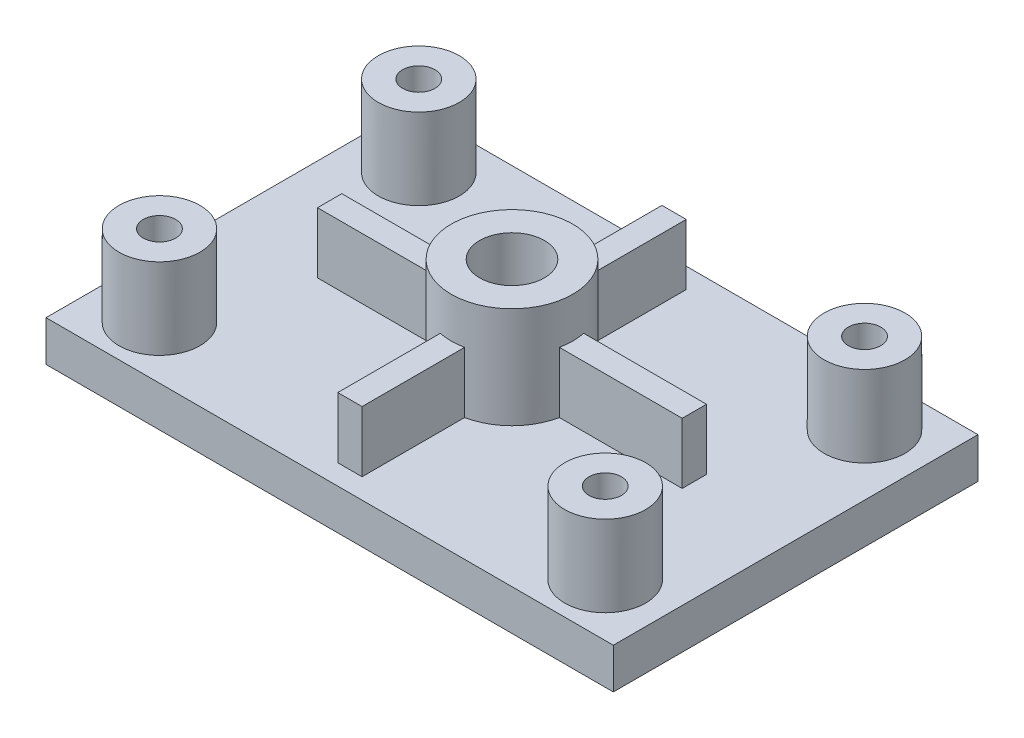
from build123d import *

# Parameters (mm, degrees)
SKETCH_1_W          = 140
SKETCH_1_H          = 90
EXTRUDE_1_DEPTH     = 10
SKETCH_2_W          = 80
SKETCH_2_H          = 50
CUT_EXTRUDE_1_DEPTH = 4
SKETCH_3_W          = 90
SKETCH_3_H          = 6
EXTRUDE_2_DEPTH     = 15
SKETCH_4_W          = 6
SKETCH_4_H          = 80
EXTRUDE_3_DEPTH     = 15
SKETCH_5_R          = 10
EXTRUDE_4_DEPTH     = 20
SKETCH_6_R          = 15
EXTRUDE_5_DEPTH     = 25
SKETCH_7_R          = 4
CUT_EXTRUDE_2_DEPTH = 141
SKETCH_8_R          = 8
CUT_EXTRUDE_3_DEPTH = 20


with BuildPart() as part:
    # 草图1 → 凸台-拉伸1 (new body)
    with BuildSketch(Plane(origin=(0, 0, 0), x_dir=(1, 0, 0), z_dir=(0, 1, 0))):
        Rectangle(SKETCH_1_W, SKETCH_1_H)
    extrude(amount=EXTRUDE_1_DEPTH)

    # 草图2 → 切除-拉伸1 (cut)
    with BuildSketch(Plane(origin=(0, 0, 0), x_dir=(1, 0, 0), z_dir=(0, 1, 0))):
        Rectangle(SKETCH_2_W, SKETCH_2_H)
    extrude(amount=CUT_EXTRUDE_1_DEPTH, mode=Mode.SUBTRACT)

    # 草图3 → 凸台-拉伸2 (add)
    with BuildSketch(Plane(origin=(0, 10, 0), x_dir=(1, 0, 0), z_dir=(0, 1, 0))):
        Rectangle(SKETCH_3_W, SKETCH_3_H)
    extrude(amount=EXTRUDE_2_DEPTH)

    # 草图4 → 凸台-拉伸3 (add)
    with BuildSketch(Plane(origin=(0, 10, 0), x_dir=(1, 0, 0), z_dir=(0, 1, 0))):
        Rectangle(SKETCH_4_W, SKETCH_4_H)
    extrude(amount=EXTRUDE_3_DEPTH)

    # 草图5 → 凸台-拉伸4 (add)
    with BuildSketch(Plane(origin=(0, 10, 0), x_dir=(1, 0, 0), z_dir=(0, 1, 0))):
        with Locations(Location((-55, 32, 0), (0, 0, 90))):
            Circle(SKETCH_5_R)
        with Locations(Location((55, 32, 0), (0, 0, 90))):
            Circle(SKETCH_5_R)
        with Locations(Location((-55, -32, 0), (0, 0, 90))):
            Circle(SKETCH_5_R)
        with Locations(Location((55, -32, 0), (0, 0, 90))):
            Circle(SKETCH_5_R)
    extrude(amount=EXTRUDE_4_DEPTH)

    # 草图6 → 凸台-拉伸5 (add)
    with BuildSketch(Plane(origin=(0, 10, 0), x_dir=(1, 0, 0), z_dir=(0, 1, 0))):
        with Locations(Location((0, 0, 0), (0, 0, 78.463040967))):
            Circle(SKETCH_6_R)
    extrude(amount=EXTRUDE_5_DEPTH)

    # 草图7 → 切除-拉伸2 (cut, symmetric)
    with BuildSketch(Plane(origin=(0, 30, 0), x_dir=(1, 0, 0), z_dir=(0, 1, 0))):
        with Locations(Location((-55, 32, 0), (0, 0, 270))):
            Circle(SKETCH_7_R)
        with Locations(Location((55, 32, 0), (0, 0, 270))):
            Circle(SKETCH_7_R)
        with Locations(Location((-55, -32, 0), (0, 0, 270))):
            Circle(SKETCH_7_R)
        with Locations(Location((55, -32, 0), (0, 0, 270))):
            Circle(SKETCH_7_R)
    extrude(amount=CUT_EXTRUDE_2_DEPTH, both=True, mode=Mode.SUBTRACT)

    # 草图8 → 切除-拉伸3 (cut)
    with BuildSketch(Plane(origin=(0, 35, 0), x_dir=(1, 0, 0), z_dir=(0, 1, 0))):
        with Locations(Location((0, 0, 0), (0, 0, 270))):
            Circle(SKETCH_8_R)
    extrude(amount=-CUT_EXTRUDE_3_DEPTH, mode=Mode.SUBTRACT)


solid = part.part
